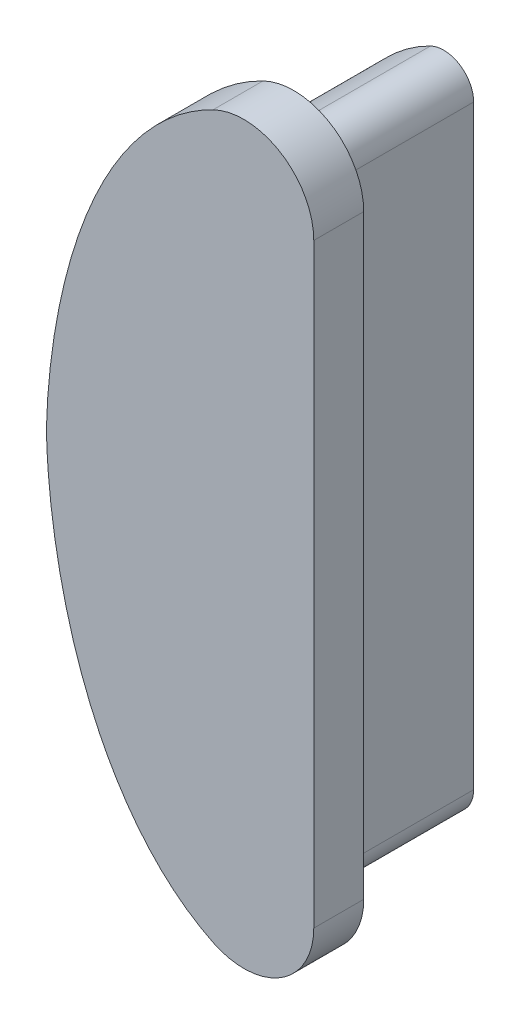
from build123d import *

# Parameters (mm, degrees)
BOSS_EXTRUDE1_DEPTH = 3
FILLET1_R           = 0.6
BOSS_EXTRUDE2_DEPTH = 1


with BuildPart() as part:
    # Sketch1 → Boss-Extrude1 (new body)
    with BuildSketch(Plane.XY):
        with BuildLine():
            Line((2.813726101, -7.233722886), (2.813726101, 6.312465104))
            add(Edge.make_bspline(
                [(2.813726101, 6.312465104), (2.504718004, 6.264404648), (1.893497156, 6.064800789), (0.890081325, 5.34240891), (-0.080852226, 3.898834313), (-0.647319625, 2.07334315), (-0.882193889, 0.581865897), (-0.93021587, -0.107691535), (-0.938912211, -0.460628891)],
                knots=[0.032675075, 0.032675075, 0.032675075, 0.032675075, 0.153501113, 0.274327151, 0.515979228, 0.757631304, 0.878457343, 0.999283381, 0.999283381, 0.999283381, 0.999283381], degree=3))
            add(Edge.make_bspline(
                [(-0.938912211, -0.460628891), (-0.93021587, -0.813566247), (-0.882193889, -1.503123679), (-0.647319625, -2.994600932), (-0.080852226, -4.820092095), (0.890081325, -6.263666692), (1.893497156, -6.986058571), (2.504718004, -7.18566243), (2.813726101, -7.233722886)],
                knots=[0.032675075, 0.032675075, 0.032675075, 0.032675075, 0.153501113, 0.274327151, 0.515979228, 0.757631304, 0.878457343, 0.999283381, 0.999283381, 0.999283381, 0.999283381], degree=3))
        make_face()
    extrude(amount=BOSS_EXTRUDE1_DEPTH)

    # Fillet1
    fillet1_edges = [part.edges().sort_by_distance(p)[0] for p in [
        (2.813726101, -7.233722886, 1.5),
        (2.813726101, 6.312465104, 1.5),
    ]]
    fillet(fillet1_edges, radius=FILLET1_R)

    # Sketch3 → Boss-Extrude2 (add)
    with BuildSketch(Plane.XY.offset(3)):
        with BuildLine():
            Line((3.613726101, -6.42120663), (3.613726101, 5.499948848))
            ThreePointArc((3.613726101, 5.499948848), (2.954184531, 6.688107639), (1.596981367, 6.756780552))
            add(Edge.make_bspline(
                [(1.596981367, 6.756780552), (1.282061762, 6.602245138), (0.994843741, 6.407135645), (0.467503364, 5.947936377), (0.233787218, 5.690400118), (-0.184066224, 5.140618178), (-0.370152574, 4.845270148), (-0.699300989, 4.232833375), (-0.841194277, 3.918340305), (-1.089857286, 3.276540027), (-1.196610753, 2.94922689), (-1.38071085, 2.283872115), (-1.458163179, 1.944713712), (-1.648747035, 0.922143409), (-1.722037558, 0.234076304), (-1.739155024, -0.460628891)],
                knots=[0, 0, 0, 0, 0.125, 0.125, 0.25, 0.25, 0.375, 0.375, 0.5, 0.5, 0.625, 0.625, 0.75, 0.75, 1, 1, 1, 1], degree=3))
            add(Edge.make_bspline(
                [(-1.739155024, -0.460628891), (-1.722036272, -1.15538629), (-1.648742974, -1.84324583), (-1.458332057, -2.865153843), (-1.380793827, -3.204774963), (-1.196784843, -3.869910467), (-0.98366247, -4.523264457), (-0.70170709, -5.148763327), (-0.375964944, -5.756542709), (-0.189209114, -6.054473312), (0.231167863, -6.608835903), (0.46405952, -6.865638613), (0.858736471, -7.210145529), (0.998171212, -7.317980735), (1.288068017, -7.512889958), (1.439226487, -7.600625828), (1.596981367, -7.678038334)],
                knots=[0, 0, 0, 0, 0.25, 0.25, 0.375, 0.375, 0.5, 0.625, 0.625, 0.75, 0.75, 0.875, 0.875, 0.9375, 0.9375, 1, 1, 1, 1], degree=3))
            ThreePointArc((1.596981367, -7.678038334), (2.954184531, -7.609365421), (3.613726101, -6.42120663))
        make_face()
    extrude(amount=BOSS_EXTRUDE2_DEPTH)


solid = part.part
